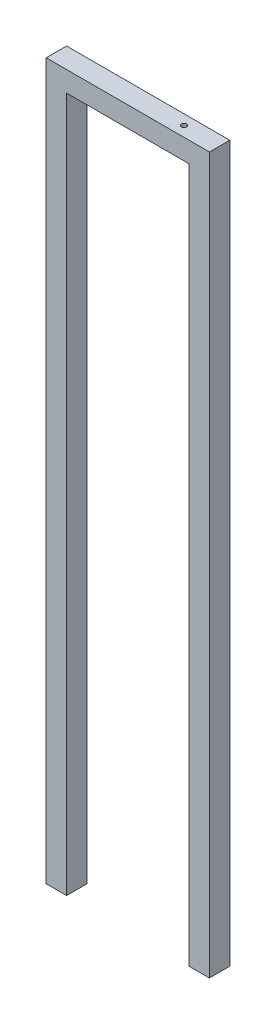
from build123d import *

# Parameters (mm, degrees)
SKETCH1_W           = 20
SKETCH1_H           = 681.33
BOSS_EXTRUDE1_DEPTH = 20
SKETCH2_R           = 2.5
CUT_EXTRUDE1_DEPTH  = 10


with BuildPart() as part:
    # Sketch1 → Boss-Extrude1 (new body)
    with BuildSketch(Plane.XY):
        with Locations((-66.54676259, -268.254928058)):
            Rectangle(SKETCH1_W, SKETCH1_H)
        with Locations((73.45323741, -268.254928058)):
            Rectangle(SKETCH1_W, SKETCH1_H)
        Polygon((-76.54676259, 92.410071942), (-76.54676259, 72.410071942), (-56.54676259, 72.410071942), (63.45323741, 72.410071942), (83.45323741, 72.410071942), (83.45323741, 92.410071942), align=None)
    extrude(amount=BOSS_EXTRUDE1_DEPTH)

    # Sketch2 → Cut-Extrude1 (cut)
    with BuildSketch(Plane(origin=(0, 92.410071942, 0), x_dir=(1, 0, 0), z_dir=(0, 1, 0))):
        with Locations(Location((48.45323741, -10, 0), (0, 0, 180))):
            Circle(SKETCH2_R)
    extrude(amount=-CUT_EXTRUDE1_DEPTH, mode=Mode.SUBTRACT)


solid = part.part
